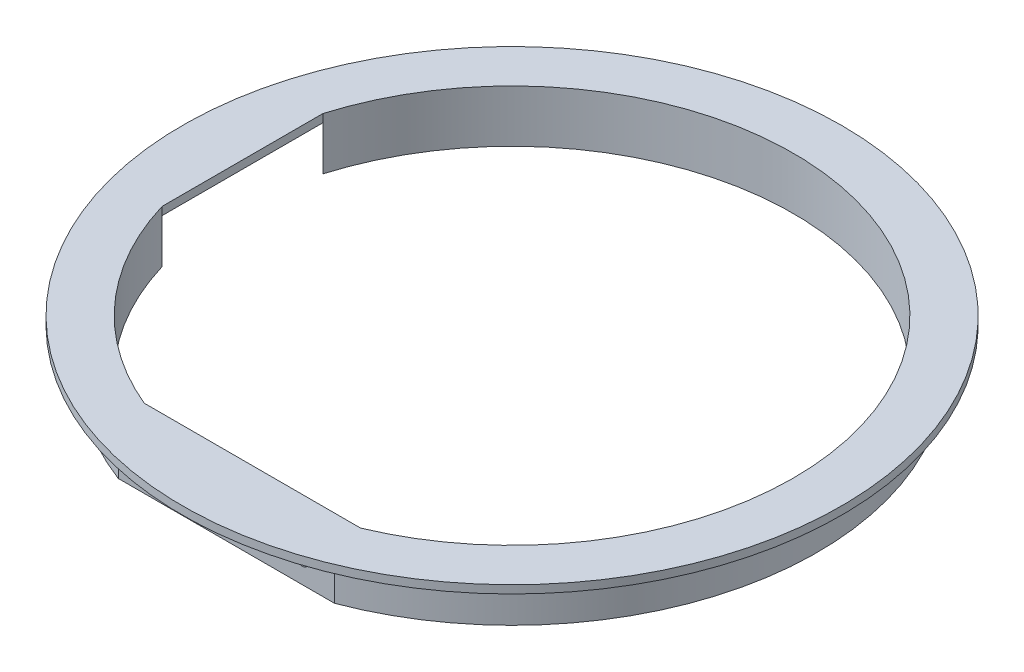
from build123d import *

# Parameters (mm, degrees)
CUT_EXTRUDE1_DEPTH             = 59.345951016
CUT_EXTRUDE3_DEPTH             = 5.5
SKETCH10_W                     = 20
SKETCH10_H                     = 5.5
CUT_EXTRUDE5_DEPTH             = 10
F_1_5_1_5_DIAMETER_HOLE1_D     = 1.5
F_1_5_1_5_DIAMETER_HOLE1_DEPTH = 3.227722445
SKETCH12_W                     = 3.119585898
SKETCH12_H                     = 5.5
CUT_EXTRUDE6_DEPTH             = 66.759029798
FILLET1_R                      = 1


with BuildPart() as part:
    # Sketch2 → Revolve1 (revolve)
    with BuildSketch(Plane(origin=(0, 0, 0), x_dir=(0, 0, -1), z_dir=(1, 0, 0))):
        Polygon((0, 0), (41, 0), (41, -1), (38, -1), (38, -6.5), (0, -6.5), align=None)
    revolve(axis=Axis((0, -6.5, 0), (0, 1, 0)))

    # Sketch3 → Cut-Extrude1 (cut, through all)
    with BuildSketch(Plane(origin=(0, 0, 0), x_dir=(1, 0, 0), z_dir=(0, 1, 0))):
        with BuildLine():
            Line((-13.453624047, -32.310988843), (13.453624047, -32.310988843))
            ThreePointArc((13.453624047, -32.310988843), (23.418599656, 26.010943661), (-33.541019662, 10))
            Line((-33.541019662, 10), (-33.541019662, -10))
            ThreePointArc((-33.541019662, -10), (-26.010943661, -23.418599656), (-13.453624047, -32.310988843))
        make_face()
    extrude(amount=-CUT_EXTRUDE1_DEPTH, mode=Mode.SUBTRACT)

    # Sketch6 → Cut-Extrude3 (cut)
    with BuildSketch(Plane.XZ.offset(6.5)):
        with BuildLine():
            Line((-13.453624047, 35.538711288), (13.453624047, 35.538711288))
            ThreePointArc((13.453624047, 35.538711288), (0, 38), (-13.453624047, 35.538711288))
        make_face()
        with BuildLine():
            Line((-36.66060556, -10), (-36.66060556, 10))
            ThreePointArc((-36.66060556, 10), (-38, 0), (-36.66060556, -10))
        make_face()
    extrude(amount=-CUT_EXTRUDE3_DEPTH, mode=Mode.SUBTRACT)

    # Sketch10 → Cut-Extrude5 (cut)
    with BuildSketch(Plane.ZY.offset(36.66060556)):
        with Locations((0, -3.75)):
            Rectangle(SKETCH10_W, SKETCH10_H)
    extrude(amount=-CUT_EXTRUDE5_DEPTH, mode=Mode.SUBTRACT)

    # Ø1.5 (1.5) Diameter Hole1
    with Locations(Plane.XY.offset(35.538711288)):
        with Locations((9.453624047, -3.75), (5.453624047, -3.75), (-5.453624047, -3.75), (-9.453624047, -3.75)):
            Hole(F_1_5_1_5_DIAMETER_HOLE1_D / 2, depth=F_1_5_1_5_DIAMETER_HOLE1_DEPTH)

    # Sketch12 → Cut-Extrude6 (cut, through all)
    with BuildSketch(Plane.XY.offset(-10)):
        with Locations((-35.100812611, -3.75)):
            Rectangle(SKETCH12_W, SKETCH12_H)
    extrude(amount=-CUT_EXTRUDE6_DEPTH, mode=Mode.SUBTRACT)

    # Fillet1
    fillet1_edges = [part.edges().sort_by_distance(p)[0] for p in [
        (-28.123218981, -1, 25.555519055),
        (0, -1, 35.538711288),
        (28.526245907, -1, -25.104846036),
    ]]
    fillet(fillet1_edges, radius=FILLET1_R)


solid = part.part
